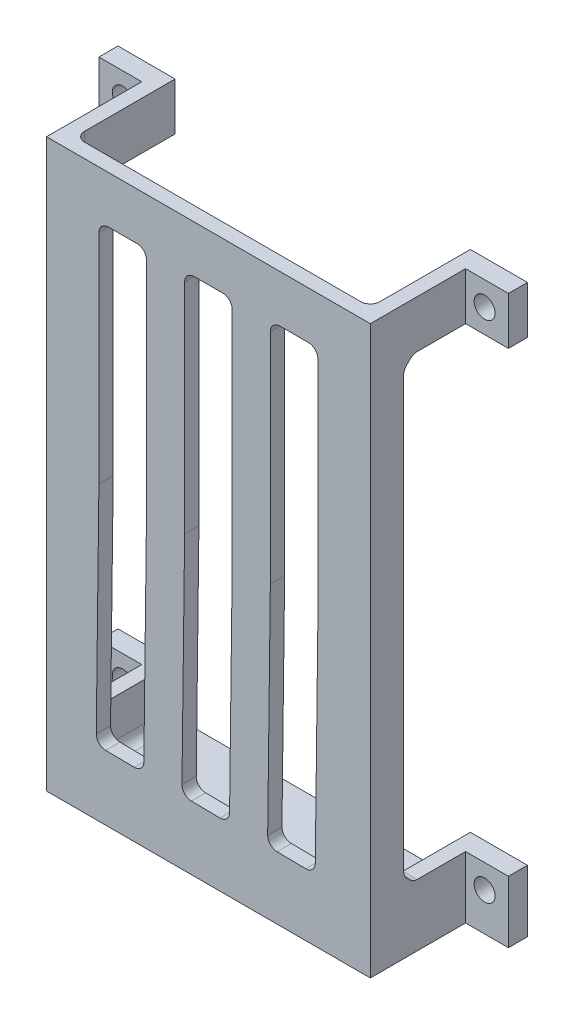
from build123d import *

# Parameters (mm, degrees)
SKETCH1_W             = 6
SKETCH1_H             = 5
SKETCH1_R             = 1.1
BOSS_EXTRUDE1_DEPTH   = 2
BOSS_EXTRUDE1_2_DEPTH = 2
BOSS_EXTRUDE1_3_DEPTH = 2
BOSS_EXTRUDE1_4_DEPTH = 2
SKETCH2_W             = 1.5
SKETCH2_H             = 5
BOSS_EXTRUDE2_DEPTH   = 10
SKETCH3_W             = 34
SKETCH3_H             = 58
BOSS_EXTRUDE3_DEPTH   = 1.5
BOSS_EXTRUDE4_DEPTH   = 1.5
CHAMFER1_SIZE         = 3
SKETCH5_W             = 1.5
SKETCH5_H             = 50
BOSS_EXTRUDE5_DEPTH   = 2
FILLET1_R             = 1
CUT_EXTRUDE1_DEPTH    = 2
FILLET2_R             = 1


with BuildPart() as part:
    # Sketch1 → Boss-Extrude1 (new body)
    with BuildSketch(Plane.XY):
        with Locations((18.5, 50.5)):
            Rectangle(SKETCH1_W, SKETCH1_H)
        with Locations((19, 50.5)):
            Circle(SKETCH1_R, mode=Mode.SUBTRACT)
    extrude(amount=BOSS_EXTRUDE1_DEPTH)



with BuildPart() as body_2:
    # Sketch1 → Boss-Extrude1 2 (new body)
    with BuildSketch(Plane.XY):
        with Locations((-18.5, 50.5)):
            Rectangle(SKETCH1_W, SKETCH1_H)
        with Locations((-19, 50.5)):
            Circle(SKETCH1_R, mode=Mode.SUBTRACT)
    extrude(amount=BOSS_EXTRUDE1_2_DEPTH)


with BuildPart() as body_3:
    # Sketch1 → Boss-Extrude1 3 (new body)
    with BuildSketch(Plane.XY):
        with Locations((18.5, -2.5)):
            Rectangle(SKETCH1_W, SKETCH1_H)
        with Locations((19, -2.5)):
            Circle(SKETCH1_R, mode=Mode.SUBTRACT)
    extrude(amount=BOSS_EXTRUDE1_3_DEPTH)


with BuildPart() as body_4:
    # Sketch1 → Boss-Extrude1 4 (new body)
    with BuildSketch(Plane.XY):
        with Locations((-18.5, -2.5)):
            Rectangle(SKETCH1_W, SKETCH1_H)
        with Locations((-19, -2.5)):
            Circle(SKETCH1_R, mode=Mode.SUBTRACT)
    extrude(amount=BOSS_EXTRUDE1_4_DEPTH)


with BuildPart() as part_1:
    add(part.part)

    add(body_2.part)  # Boss-Extrude2 merges body 2

    add(body_3.part)  # Boss-Extrude2 merges body 3

    add(body_4.part)  # Boss-Extrude2 merges body 4
    # Sketch2 → Boss-Extrude2 (add)
    with BuildSketch(Plane.XY.offset(2)):
        with Locations((16.25, 50.5)):
            Rectangle(SKETCH2_W, SKETCH2_H)
        with Locations((16.25, -2.5)):
            Rectangle(SKETCH2_W, SKETCH2_H)
        with Locations((-16.25, -2.5)):
            Rectangle(SKETCH2_W, SKETCH2_H)
        with Locations((-16.25, 50.5)):
            Rectangle(SKETCH2_W, SKETCH2_H)
    extrude(amount=BOSS_EXTRUDE2_DEPTH)

    # Sketch3 → Boss-Extrude3 (add)
    with BuildSketch(Plane.XY.offset(12)):
        with Locations((0, 24)):
            Rectangle(SKETCH3_W, SKETCH3_H)
    extrude(amount=-BOSS_EXTRUDE3_DEPTH)

    # Sketch4 → Boss-Extrude4 (add)
    with BuildSketch(Plane.XZ.offset(5)):
        Polygon((-15.5, 0), (15.5, 0), (21.5, 0), (21.5, 2), (17, 2), (17, 12), (-17, 12), (-17, 2), (-21.5, 2), (-21.5, 0), align=None)
    extrude(amount=BOSS_EXTRUDE4_DEPTH)

    # Chamfer1
    chamfer1_edges = [part_1.edges().sort_by_distance(p)[0] for p in [
        (16.25, 48, 10.5),
        (-16.25, 48, 10.5),
        (16.25, 0, 10.5),
        (-16.25, 0, 10.5),
    ]]
    chamfer(chamfer1_edges, length=CHAMFER1_SIZE)

    # Sketch5 → Boss-Extrude5 (add)
    with BuildSketch(Plane(origin=(0, 0, 10.5), x_dir=(-1, 0, 0), z_dir=(0, 0, -1))):
        with Locations((16.25, 24)):
            Rectangle(SKETCH5_W, SKETCH5_H)
        with Locations((-16.25, 24)):
            Rectangle(SKETCH5_W, SKETCH5_H)
    extrude(amount=BOSS_EXTRUDE5_DEPTH)

    # Fillet1
    fillet1_edges = [part_1.edges().sort_by_distance(p)[0] for p in [
        (-16.25, 0, 7.5),
        (-16.25, 48, 7.5),
        (16.25, 0, 7.5),
        (16.25, 48, 7.5),
        (16.25, 47, 8.5),
        (16.25, 1, 8.5),
        (-16.25, 1, 8.5),
        (15.5, 24, 10.5),
        (-15.5, 24, 10.5),
        (15.5, -5, 5.25),
        (0, -5, 10.5),
        (-15.5, -5, 5.25),
    ]]
    fillet(fillet1_edges, radius=FILLET1_R)

    # Sketch6 → Cut-Extrude1 (cut)
    with BuildSketch(Plane(origin=(0, 0, 10.5), x_dir=(-1, 0, 0), z_dir=(0, 0, -1))):
        Polygon((-6.5, 48.033502568), (-11.5, 48.033502568), (-11.5, 24.033502568), (-11.207624805, 0.035283535), (-6.207995839, 0.096195034), (-6.5, 24.063959447), align=None)
        Polygon((-2.5, 48.033502568), (-2.5, 24.088324951), (-2.208292667, 0.144924233), (2.791336298, 0.205835732), (2.5, 24.11878183), (2.5, 48.033502568), align=None)
        Polygon((11.5, 48.033502568), (6.5, 48.033502568), (6.5, 24.143147334), (6.79103947, 0.254564931), (11.790668435, 0.31547643), (11.5, 24.173604214), align=None)
    extrude(amount=-CUT_EXTRUDE1_DEPTH, mode=Mode.SUBTRACT)

    # Fillet2
    fillet2_edges = [part_1.edges().sort_by_distance(p)[0] for p in [
        (11.207624805, 0.035283535, 11.25),
        (11.5, 48.033502568, 11.25),
        (6.5, 48.033502568, 11.25),
        (6.207995839, 0.096195034, 11.25),
        (-2.791336298, 0.205835732, 11.25),
        (2.208292667, 0.144924233, 11.25),
        (2.5, 48.033502568, 11.25),
        (-2.5, 48.033502568, 11.25),
        (-6.79103947, 0.254564931, 11.25),
        (-6.5, 48.033502568, 11.25),
        (-11.5, 48.033502568, 11.25),
        (-11.790668435, 0.31547643, 11.25),
    ]]
    fillet(fillet2_edges, radius=FILLET2_R)


solid = part_1.part
